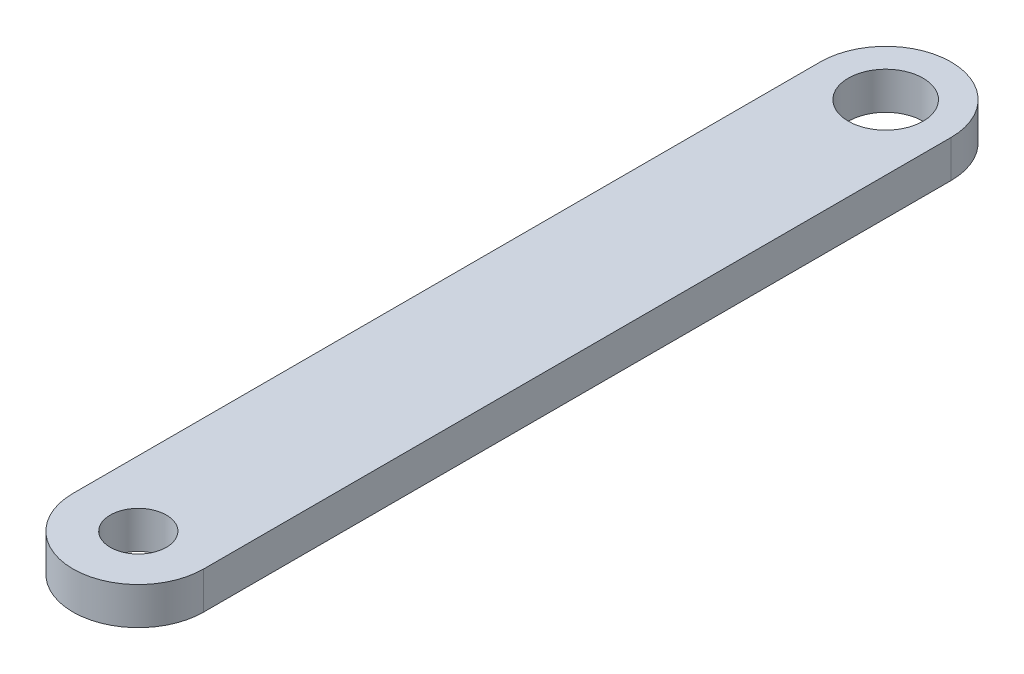
from build123d import *

# Parameters (mm, degrees)
SKETCH1_R           = 2
SKETCH1_R_2         = 1.5
BOSS_EXTRUDE1_DEPTH = 2


with BuildPart() as part:
    # Sketch1 → Boss-Extrude1 (new body)
    with BuildSketch(Plane(origin=(0, 0, 0), x_dir=(1, 0, 0), z_dir=(0, 1, 0))):
        with BuildLine():
            Line((3.5, 20), (3.5, -20))
            ThreePointArc((3.5, -20), (0, -23.5), (-3.5, -20))
            Line((-3.5, -20), (-3.5, 20))
            ThreePointArc((-3.5, 20), (0, 23.5), (3.5, 20))
        make_face()
        with Locations(Location((0, 20, 0), (0, 0, 270))):
            Circle(SKETCH1_R, mode=Mode.SUBTRACT)
        with Locations(Location((0, -20, 0), (0, 0, 270))):
            Circle(SKETCH1_R_2, mode=Mode.SUBTRACT)
    extrude(amount=BOSS_EXTRUDE1_DEPTH)


solid = part.part
